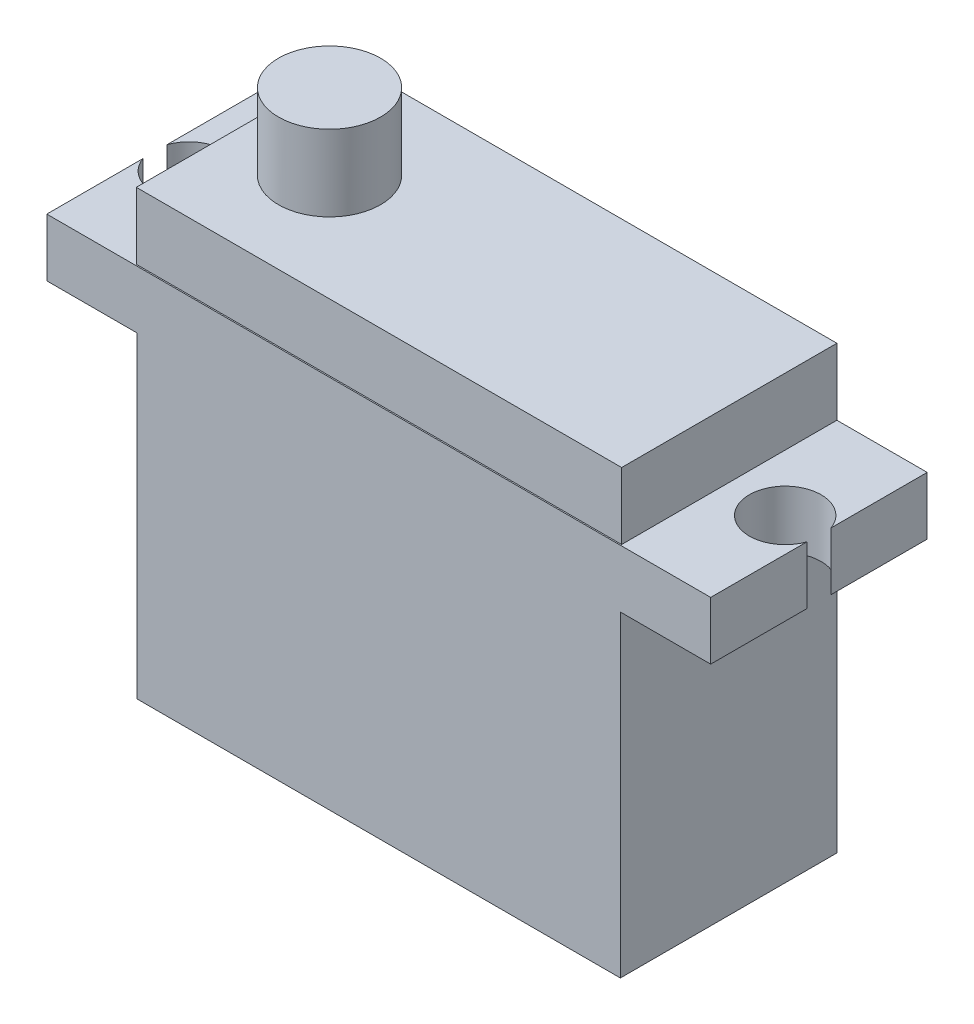
from build123d import *

# Parameters (mm, degrees)
SKETCH1_W           = 29.083
SKETCH1_H           = 13.0302
BOSS_EXTRUDE1_DEPTH = 19.0754
SKETCH2_W           = 39.9542
SKETCH2_H           = 13.0302
BOSS_EXTRUDE2_DEPTH = 3.4798
SKETCH3_W           = 29.21
SKETCH3_H           = 12.954
BOSS_EXTRUDE3_DEPTH = 4.0132
SKETCH4_R           = 3.071074645
BOSS_EXTRUDE4_DEPTH = 4.572
SKETCH5_R           = 2.159
CUT_EXTRUDE1_DEPTH  = 3.4798


with BuildPart() as part:
    # Sketch1 → Boss-Extrude1 (new body)
    with BuildSketch(Plane(origin=(0, 0, 0), x_dir=(1, 0, 0), z_dir=(0, 1, 0))):
        Rectangle(SKETCH1_W, SKETCH1_H)
    extrude(amount=BOSS_EXTRUDE1_DEPTH)

    # Sketch2 → Boss-Extrude2 (add)
    with BuildSketch(Plane(origin=(0, 19.0754, 0), x_dir=(1, 0, 0), z_dir=(0, 1, 0))):
        Rectangle(SKETCH2_W, SKETCH2_H)
    extrude(amount=BOSS_EXTRUDE2_DEPTH)

    # Sketch3 → Boss-Extrude3 (add)
    with BuildSketch(Plane(origin=(0, 22.5552, 0), x_dir=(1, 0, 0), z_dir=(0, 1, 0))):
        with Locations((-0.0635, 0.0381)):
            Rectangle(SKETCH3_W, SKETCH3_H)
    extrude(amount=BOSS_EXTRUDE3_DEPTH)

    # Sketch4 → Boss-Extrude4 (add)
    with BuildSketch(Plane(origin=(0, 26.5684, 0), x_dir=(1, 0, 0), z_dir=(0, 1, 0))):
        with Locations(Location((-9.4771, 0, 0), (0, 0, 90))):
            Circle(SKETCH4_R)
    extrude(amount=BOSS_EXTRUDE4_DEPTH)

    # Sketch5 → Cut-Extrude1 (cut)
    with BuildSketch(Plane(origin=(0, 22.5552, 0), x_dir=(1, 0, 0), z_dir=(0, 1, 0))):
        with Locations((-17.9451, 0)):
            Circle(SKETCH5_R)
        with Locations((17.9451, 0)):
            Circle(SKETCH5_R)
    extrude(amount=-CUT_EXTRUDE1_DEPTH, mode=Mode.SUBTRACT)


solid = part.part
